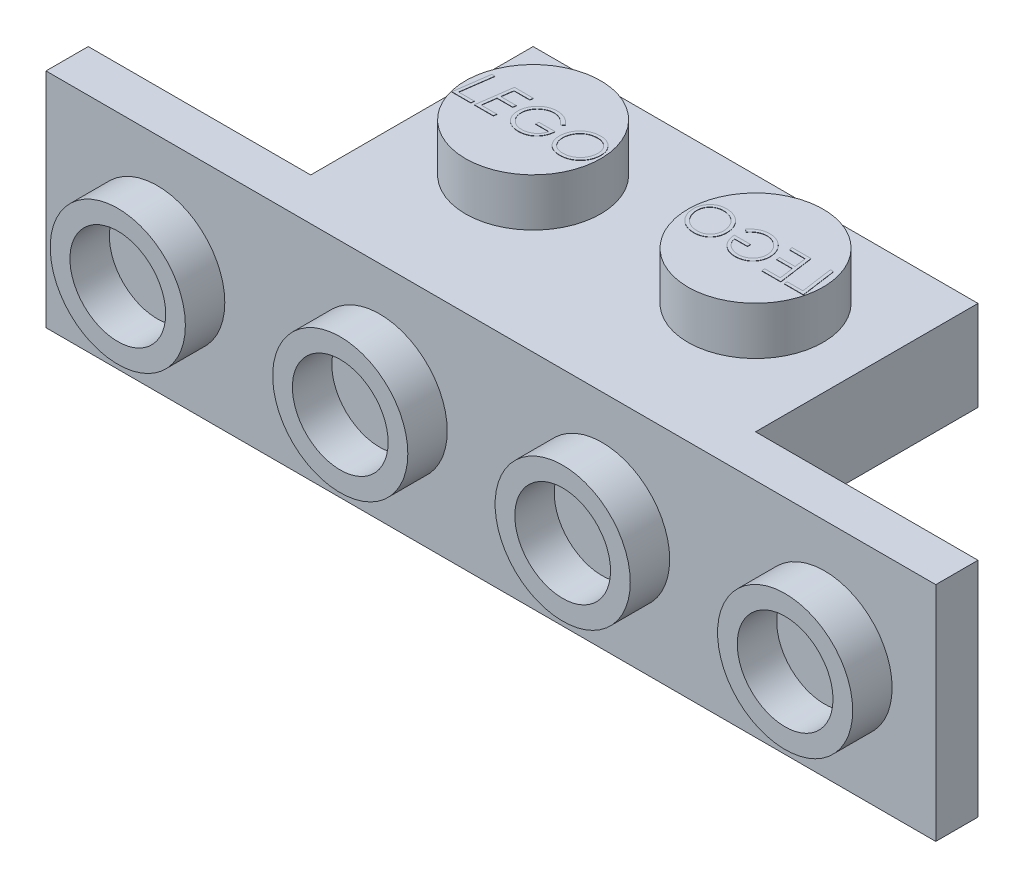
from build123d import *

# Parameters (mm, degrees)
SKETCH1_W           = 7.9
SKETCH1_H           = 7.9
BOSS_EXTRUDE1_DEPTH = 3.2
SKETCH2_R           = 2.4
BOSS_EXTRUDE2_DEPTH = 1.7
BOSS_EXTRUDE4_DEPTH = 0.01
SKETCH4_W           = 6.679581062
SKETCH4_H           = 6.679581062
CUT_EXTRUDE1_DEPTH  = 2.01
BOSS_EXTRUDE5_START = -2.01
BOSS_EXTRUDE5_DEPTH = 2.01
SKETCH6_W           = 7.9
SKETCH6_H           = 3.2
BOSS_EXTRUDE6_DEPTH = 1.5
SKETCH7_R           = 2.4
SKETCH7_R_2         = 1.7
BOSS_EXTRUDE7_DEPTH = 1.4


with BuildPart() as part:
    # Sketch1 → Boss-Extrude1 (new body)
    with BuildSketch(Plane(origin=(0, 0, 0), x_dir=(1, 0, 0), z_dir=(0, 1, 0))):
        with Locations((3.95, 3.95)):
            Rectangle(SKETCH1_W, SKETCH1_H)
    extrude(amount=BOSS_EXTRUDE1_DEPTH)

    # Sketch2 → Boss-Extrude2 (add)
    with BuildSketch(Plane(origin=(0, 3.2, 0), x_dir=(1, 0, 0), z_dir=(0, 1, 0))):
        with Locations(Location((3.95, 3.95, 0), (0, 0, 270))):
            Circle(SKETCH2_R)
    extrude(amount=BOSS_EXTRUDE2_DEPTH)

    # Sketch3 → Boss-Extrude4 (add)
    # profile 1 of 4: a face of its own
    with BuildSketch(Plane(origin=(0, 4.9, 0), x_dir=(1, 0, 0), z_dir=(0, 1, 0))):
        Polygon((1.832282536, 4.604898123), (1.945463626, 4.604898123), (1.785708017, 3.46707761), (2.346104652, 3.46707761), (2.331831815, 3.354898123), (1.657002088, 3.354898123), align=None)
    # profile 2 of 4: a face of its own
    with BuildSketch(Plane(origin=(0, 4.9, 0), x_dir=(1, 0, 0), z_dir=(0, 1, 0))):
        Polygon((3.307643113, 4.604898123), (3.289864668, 4.492718636), (2.730720036, 4.492718636), (2.672376687, 4.076051969), (3.227514908, 4.076051969), (3.211489267, 3.963872482), (2.656351046, 3.963872482), (2.586990069, 3.46707761), (3.147386703, 3.46707761), (3.132863466, 3.354898123), (2.458284139, 3.354898123), (2.633564588, 4.604898123), align=None)
    # profile 3 of 4: a face of its own
    with BuildSketch(Plane(origin=(0, 4.9, 0), x_dir=(1, 0, 0), z_dir=(0, 1, 0))):
        with BuildLine():
            Line((4.701873883, 4.341727049), (4.602214428, 4.268359661))
            add(Edge.make_bspline(
                [(4.602214428, 4.268359661), (4.594223081, 4.278463296), (4.578382454, 4.298490949), (4.552974208, 4.326751799), (4.526781942, 4.353389692), (4.49925824, 4.377917229), (4.471083571, 4.40112998), (4.441525281, 4.42204341), (4.410978563, 4.441207159), (4.379659496, 4.458649755), (4.347610579, 4.474125482), (4.315396207, 4.487732834), (4.282869127, 4.498922357), (4.250283005, 4.50864136), (4.217299487, 4.51587276), (4.18414763, 4.520710487), (4.150903008, 4.524293062), (4.128633082, 4.524610402), (4.117438786, 4.524769918)],
                knots=[0, 0, 0, 0, 1.088205139, 2.157064813, 3.209299296, 4.24303109, 5.270682624, 6.292193363, 7.299904734, 8.316436989, 9.319473328, 10.305733085, 11.269264382, 12.22444877, 13.177574148, 14.119122834, 15.054550362, 16, 16, 16, 16], degree=3))
            add(Edge.make_bspline(
                [(4.117438786, 4.524769918), (4.104994375, 4.524521107), (4.080132736, 4.524024028), (4.043033101, 4.520256885), (4.006376299, 4.51354748), (3.969908323, 4.504926578), (3.933893833, 4.493301772), (3.898252767, 4.479273564), (3.86309309, 4.462612711), (3.828430169, 4.443710217), (3.794953431, 4.422557236), (3.762954424, 4.399818018), (3.733183783, 4.375017311), (3.704650221, 4.34913067), (3.678490591, 4.320990985), (3.654040353, 4.291325456), (3.631570613, 4.259970376), (3.610753816, 4.22729124), (3.592321888, 4.193377608), (3.576332398, 4.158696131), (3.562301633, 4.123622124), (3.551463822, 4.087613068), (3.542488613, 4.051135011), (3.536702509, 4.013925289), (3.532682003, 3.976230124), (3.532229884, 3.950862463), (3.532002088, 3.938081216)],
                knots=[0, 0, 0, 0, 0.97704485, 1.95195533, 2.923843304, 3.901415526, 4.89212417, 5.89249681, 6.906854198, 7.94508701, 8.99059592, 10.014519948, 11.024825533, 12.031297736, 13.037428488, 14.038509295, 15.047964276, 16.064309815, 17.079005887, 18.075937854, 19.061713623, 20.042247028, 21.026191147, 22.008802999, 22.996754876, 24, 24, 24, 24], degree=3))
            add(Edge.make_bspline(
                [(3.532002088, 3.938081216), (3.532369323, 3.920940483), (3.533092921, 3.887166428), (3.54080397, 3.83756171), (3.552297071, 3.789703796), (3.569345009, 3.743984102), (3.590663785, 3.700113704), (3.616898701, 3.658340736), (3.647995923, 3.618632516), (3.683169388, 3.581124089), (3.721975609, 3.547190184), (3.762989457, 3.517071082), (3.806208637, 3.491553815), (3.851780792, 3.471217023), (3.899058754, 3.454481236), (3.948703848, 3.443615036), (4.000192874, 3.436168993), (4.035279814, 3.435410998), (4.053085822, 3.435026328)],
                knots=[0, 0, 0, 0, 1.019699772, 2.00921373, 2.981850619, 3.945611549, 4.907936516, 5.881372837, 6.876399243, 7.906447893, 8.938173367, 9.941073143, 10.932270214, 11.919723139, 12.908225854, 13.912405215, 14.940582182, 16, 16, 16, 16], degree=3))
            add(Edge.make_bspline(
                [(4.053085822, 3.435026328), (4.074581254, 3.435599426), (4.11748625, 3.436743331), (4.180872469, 3.447608002), (4.243162184, 3.464003995), (4.303115661, 3.48756372), (4.359892332, 3.516274774), (4.411741714, 3.54979345), (4.457784869, 3.587961635), (4.498384943, 3.630580026), (4.53303885, 3.678554542), (4.563120551, 3.731230233), (4.587740602, 3.789373269), (4.599634966, 3.830601123), (4.605720036, 3.851692995)],
                knots=[0, 0, 0, 0, 1.033792167, 2.063454529, 3.086685911, 4.12966393, 5.157365104, 6.144632769, 7.094686579, 8.02963692, 8.969786061, 9.935985671, 10.944065236, 12, 12, 12, 12], degree=3))
            Line((4.605720036, 3.851692995), (4.140976447, 3.851692995))
            Line((4.140976447, 3.851692995), (4.140976447, 3.963872482))
            Line((4.140976447, 3.963872482), (4.717899524, 3.963872482))
            add(Edge.make_bspline(
                [(4.717899524, 3.963872482), (4.715864452, 3.940537279), (4.711874195, 3.894782885), (4.69942647, 3.828086612), (4.68199329, 3.764774229), (4.659173945, 3.704861641), (4.630919519, 3.648505742), (4.59774963, 3.595348644), (4.559285746, 3.545571633), (4.515814341, 3.499721655), (4.46844757, 3.458302738), (4.417878433, 3.421925394), (4.364351012, 3.391393009), (4.308182236, 3.366007973), (4.248908241, 3.346854494), (4.187007442, 3.33278705), (4.12217798, 3.324364805), (4.078067373, 3.323359246), (4.055589828, 3.322846841)],
                knots=[0, 0, 0, 0, 1.098006248, 2.152910829, 3.176693714, 4.174102283, 5.154427425, 6.128677043, 7.108165613, 8.099464247, 9.087077226, 10.054952015, 11.015803916, 11.972468591, 12.940477937, 13.931877037, 14.946141749, 16, 16, 16, 16], degree=3))
            add(Edge.make_bspline(
                [(4.055589828, 3.322846841), (4.032525547, 3.323342362), (3.987411429, 3.324311611), (3.9214857, 3.332876212), (3.858807865, 3.34620412), (3.799404334, 3.365318809), (3.743277296, 3.389857102), (3.690679177, 3.420179827), (3.641268759, 3.455657405), (3.595689928, 3.496348401), (3.554559756, 3.541197331), (3.518567584, 3.589307242), (3.487743642, 3.639999747), (3.462901044, 3.693721351), (3.443468533, 3.750181555), (3.429856098, 3.809437188), (3.421311108, 3.871476007), (3.420325278, 3.913764014), (3.419822601, 3.935326809)],
                knots=[0, 0, 0, 0, 1.117903688, 2.186638197, 3.21780727, 4.221242465, 5.20706516, 6.182431358, 7.159609539, 8.151436913, 9.139682433, 10.10533578, 11.060397566, 12.011007066, 12.969638005, 13.950363306, 14.954883424, 16, 16, 16, 16], degree=3))
            add(Edge.make_bspline(
                [(3.419822601, 3.935326809), (3.420138952, 3.950859376), (3.420767729, 3.981731803), (3.424963713, 4.027616327), (3.432679126, 4.072646659), (3.442852825, 4.116910735), (3.455965552, 4.160496846), (3.471933961, 4.20328178), (3.491087489, 4.245242481), (3.513047729, 4.286115161), (3.537530339, 4.325600602), (3.564271155, 4.363247138), (3.593498243, 4.398542313), (3.624507556, 4.432098501), (3.658146201, 4.463054417), (3.693847346, 4.491888255), (3.731480716, 4.518905381), (3.77142415, 4.543221398), (3.812846375, 4.565137356), (3.855118915, 4.584605211), (3.898469674, 4.600573637), (3.942428974, 4.613905323), (3.987291028, 4.624144078), (4.032916476, 4.631801844), (4.079465257, 4.63599767), (4.110753822, 4.636631416), (4.12645321, 4.636949405)],
                knots=[0, 0, 0, 0, 1.01034602, 2.008157081, 2.993527994, 3.979930372, 4.960683832, 5.951959865, 6.948100503, 7.958563211, 8.967975239, 9.968308804, 10.959584837, 11.946808627, 12.938010319, 13.930059161, 14.930392727, 15.949048275, 16.969091794, 17.977364349, 18.973726886, 19.971641333, 20.963333569, 21.964771492, 22.978801278, 24, 24, 24, 24], degree=3))
            add(Edge.make_bspline(
                [(4.12645321, 4.636949405), (4.140647989, 4.63666956), (4.168739982, 4.636115737), (4.210476499, 4.63288549), (4.251380819, 4.627152534), (4.29129634, 4.618801418), (4.330484053, 4.608567941), (4.368675988, 4.59577053), (4.406070924, 4.580754735), (4.442474857, 4.563343269), (4.478143584, 4.543914061), (4.512619765, 4.521658579), (4.546625807, 4.497640881), (4.579591338, 4.471153536), (4.611552577, 4.442077414), (4.642675265, 4.410871755), (4.673242279, 4.377555225), (4.692243855, 4.353777591), (4.701873883, 4.341727049)],
                knots=[0, 0, 0, 0, 1.015105213, 2.008930748, 2.991454354, 3.966534974, 4.923490216, 5.886087319, 6.844809209, 7.803252371, 8.770243484, 9.747130909, 10.735853235, 11.746297741, 12.768902994, 13.824016992, 14.897208497, 16, 16, 16, 16], degree=3))
        make_face()
    # profile 4 of 4: a face of its own
    with BuildSketch(Plane(origin=(0, 4.9, 0), x_dir=(1, 0, 0), z_dir=(0, 1, 0))):
        with BuildLine():
            add(Edge.make_bspline(
                [(5.671925966, 4.636949405), (5.692400623, 4.63650345), (5.732667893, 4.635626396), (5.791703582, 4.627669814), (5.84816478, 4.614697282), (5.901922783, 4.596339067), (5.953136821, 4.572927607), (6.001690741, 4.544284414), (6.047399306, 4.510158163), (6.09025375, 4.471611385), (6.129154607, 4.429051867), (6.163160058, 4.383201547), (6.192058383, 4.334734533), (6.215910086, 4.283554512), (6.233823478, 4.229366588), (6.246743033, 4.172603876), (6.255145963, 4.113110877), (6.255950492, 4.072491917), (6.256361062, 4.051763107)],
                knots=[0, 0, 0, 0, 1.061681398, 2.087996504, 3.083659545, 4.062660971, 5.02945529, 5.999994507, 6.981138296, 7.983640916, 8.985844288, 9.966988076, 10.939736476, 11.908342154, 12.890058995, 13.894159216, 14.925339913, 16, 16, 16, 16], degree=3))
            add(Edge.make_bspline(
                [(6.256361062, 4.051763107), (6.25623821, 4.038988627), (6.255995471, 4.01374805), (6.253408976, 3.976225127), (6.249128591, 3.939561124), (6.243455349, 3.903597875), (6.235835613, 3.868539787), (6.226924527, 3.834140064), (6.216051359, 3.800598383), (6.20384118, 3.767696929), (6.189792262, 3.735595516), (6.173946521, 3.704324105), (6.15669213, 3.673663515), (6.137607818, 3.643838863), (6.11686312, 3.614849105), (6.094393683, 3.586665409), (6.070489857, 3.559187301), (6.044887258, 3.532733386), (6.018336956, 3.507212599), (5.990529993, 3.48355884), (5.962091012, 3.461350566), (5.932834084, 3.440746086), (5.90250067, 3.422121085), (5.871581935, 3.404690573), (5.839905885, 3.388861691), (5.807185809, 3.375183309), (5.773789823, 3.362832151), (5.739620564, 3.352089492), (5.704582969, 3.343076229), (5.668762424, 3.335500733), (5.632062087, 3.329787275), (5.594535036, 3.325855801), (5.556279304, 3.323200874), (5.530454147, 3.322965537), (5.51742877, 3.322846841)],
                knots=[0, 0, 0, 0, 1.057694632, 2.089855924, 3.112648636, 4.113725536, 5.103331559, 6.082381806, 7.055068159, 8.021768845, 8.98743121, 9.954922249, 10.923671581, 11.89959402, 12.885451751, 13.874212627, 14.883322035, 15.900071676, 16.921812937, 17.931632203, 18.921551953, 19.909055848, 20.892997665, 21.867769094, 22.84762411, 23.823252803, 24.802912784, 25.795362855, 26.787788858, 27.797679081, 28.826061376, 29.861826465, 30.921574152, 32, 32, 32, 32], degree=3))
            add(Edge.make_bspline(
                [(5.51742877, 3.322846841), (5.495540081, 3.323312388), (5.45279647, 3.324221496), (5.390401025, 3.331753811), (5.331466149, 3.34468508), (5.275615882, 3.361975519), (5.223270197, 3.38492417), (5.174339628, 3.412892082), (5.128783581, 3.445910526), (5.086763869, 3.483632016), (5.049135515, 3.525626819), (5.016044394, 3.570822838), (4.988418107, 3.619388761), (4.96538613, 3.670881503), (4.948106883, 3.725740589), (4.935156589, 3.783416472), (4.927613141, 3.844314319), (4.926699871, 3.88597706), (4.926232857, 3.907281937)],
                knots=[0, 0, 0, 0, 1.121422378, 2.189881799, 3.214223923, 4.209829567, 5.180887389, 6.136870002, 7.092517675, 8.058664933, 9.02481219, 9.976998316, 10.923432162, 11.882748215, 12.86205079, 13.865508147, 14.908495107, 16, 16, 16, 16], degree=3))
            add(Edge.make_bspline(
                [(4.926232857, 3.907281937), (4.92651465, 3.92390256), (4.927073619, 3.956871533), (4.931757127, 4.005792823), (4.939128338, 4.053761359), (4.950024433, 4.100549976), (4.963594459, 4.14639076), (4.979990494, 4.191253803), (5.000003008, 4.234848241), (5.022452359, 4.277389438), (5.047513645, 4.318359564), (5.07559856, 4.356880644), (5.105216605, 4.393691441), (5.137816677, 4.42780852), (5.172496353, 4.459796588), (5.209524734, 4.489546335), (5.248906172, 4.516814917), (5.290422211, 4.541753927), (5.333531205, 4.564369022), (5.378335052, 4.583562961), (5.424193072, 4.600182058), (5.471345954, 4.613795807), (5.519847317, 4.623918047), (5.569406413, 4.631466127), (5.620254649, 4.636113027), (5.6545551, 4.636668231), (5.671925966, 4.636949405)],
                knots=[0, 0, 0, 0, 1.027038055, 2.037251559, 3.03463374, 4.024476576, 5.003805404, 5.987972729, 6.973761106, 7.966047439, 8.95963362, 9.938921687, 10.910571097, 11.877553313, 12.852319973, 13.824735949, 14.81069978, 15.81041387, 16.816403723, 17.816876174, 18.82042938, 19.829469955, 20.847307225, 21.880377804, 22.926554263, 24, 24, 24, 24], degree=3))
        make_face()
        with BuildLine():
            add(Edge.make_bspline(
                [(5.671925966, 4.524769918), (5.65697579, 4.524545747), (5.627444828, 4.524102944), (5.583747158, 4.520086709), (5.541191397, 4.514393729), (5.499970629, 4.505322476), (5.459846772, 4.494612055), (5.421182876, 4.480527241), (5.383524652, 4.464643931), (5.34726264, 4.446055377), (5.312516644, 4.425361321), (5.279529586, 4.402463835), (5.248469657, 4.377453479), (5.219370347, 4.350164922), (5.191739723, 4.321307483), (5.166361885, 4.289965789), (5.142845474, 4.256628787), (5.121196386, 4.221501346), (5.10164712, 4.185107003), (5.08492909, 4.147719282), (5.070612165, 4.109847114), (5.058744989, 4.071497155), (5.049737471, 4.032481304), (5.043287884, 3.99291855), (5.039049877, 3.95269661), (5.03862585, 3.92565532), (5.038412344, 3.912039549)],
                knots=[0, 0, 0, 0, 1.093710758, 2.16039807, 3.20900896, 4.233234191, 5.246749975, 6.245527847, 7.241594159, 8.235879922, 9.224691631, 10.198908654, 11.171861231, 12.139893662, 13.116290872, 14.093089164, 15.087825051, 16.099756899, 17.110766713, 18.108591704, 19.094380672, 20.071961556, 21.043859171, 22.021859724, 23.00397114, 24, 24, 24, 24], degree=3))
            add(Edge.make_bspline(
                [(5.038412344, 3.912039549), (5.038625982, 3.900599914), (5.039049193, 3.877938292), (5.041777549, 3.844392517), (5.046595514, 3.811801965), (5.053065301, 3.780081073), (5.061542906, 3.749273697), (5.072183234, 3.719394567), (5.084405544, 3.690349568), (5.098393626, 3.662290632), (5.114175341, 3.635553687), (5.131389377, 3.61020951), (5.150226394, 3.586682218), (5.170360361, 3.564729612), (5.191972025, 3.544421151), (5.214980987, 3.52555365), (5.239648771, 3.508615875), (5.265465573, 3.492943288), (5.292687864, 3.479247808), (5.321165948, 3.467438697), (5.350786278, 3.457432665), (5.381544214, 3.449135171), (5.413524888, 3.442928532), (5.44663118, 3.438448028), (5.480905707, 3.435639812), (5.504152208, 3.435232585), (5.515926367, 3.435026328)],
                knots=[0, 0, 0, 0, 1.083699529, 2.146780792, 3.185591126, 4.202843058, 5.211856999, 6.209655863, 7.20532214, 8.195415879, 9.177202942, 10.14436246, 11.095191523, 12.029705806, 12.963818608, 13.902338257, 14.845476191, 15.796042213, 16.761390084, 17.729066592, 18.714222808, 19.721158958, 20.74459932, 21.797962164, 22.884686177, 24, 24, 24, 24], degree=3))
            add(Edge.make_bspline(
                [(5.515926367, 3.435026328), (5.530044188, 3.435228857), (5.558004277, 3.435629962), (5.599524853, 3.440000997), (5.64032433, 3.445959686), (5.680325762, 3.455225454), (5.71965402, 3.466535035), (5.757982705, 3.481070895), (5.795756024, 3.497476377), (5.83237428, 3.51683082), (5.867802238, 3.538111172), (5.901266528, 3.561837848), (5.932774032, 3.587459191), (5.962816859, 3.614626895), (5.990234918, 3.644356353), (6.016009711, 3.675809964), (6.039684501, 3.709331455), (6.061465654, 3.744601276), (6.080935982, 3.781209824), (6.097718361, 3.818903041), (6.112024773, 3.857287248), (6.123844079, 3.896320217), (6.132886835, 3.936161865), (6.139301688, 3.976648339), (6.14355343, 4.017951988), (6.143970816, 4.04574289), (6.144181575, 4.059775927)],
                knots=[0, 0, 0, 0, 1.029812959, 2.039525905, 3.043952503, 4.036919093, 5.033391511, 6.027870106, 7.026035071, 8.036794627, 9.047957848, 10.039952554, 11.027355318, 12.010276797, 12.992858524, 13.975534638, 14.976019862, 15.985163142, 16.99876328, 17.999396818, 18.993875413, 19.986244033, 20.973271002, 21.972624612, 22.976275263, 24, 24, 24, 24], degree=3))
            add(Edge.make_bspline(
                [(6.144181575, 4.059775927), (6.143688983, 4.077993105), (6.142724583, 4.113658826), (6.13551886, 4.16576722), (6.122807184, 4.214771606), (6.105892747, 4.261149785), (6.083400704, 4.304354629), (6.056090597, 4.344736825), (6.024020374, 4.382453222), (5.999069145, 4.404451295), (5.986429171, 4.415595238)],
                knots=[0, 0, 0, 0, 1.085318323, 2.124844004, 3.126009127, 4.096923137, 5.060061729, 6.020100862, 6.997008382, 8, 8, 8, 8], degree=3))
            add(Edge.make_bspline(
                [(5.986429171, 4.415595238), (5.97539623, 4.42431843), (5.953439426, 4.44167857), (5.917982347, 4.463870828), (5.881057133, 4.482788681), (5.842389242, 4.498145486), (5.802091847, 4.510165945), (5.760106575, 4.518646998), (5.716539836, 4.523741692), (5.686963766, 4.524423338), (5.671925966, 4.524769918)],
                knots=[0, 0, 0, 0, 0.992364662, 1.974918139, 2.947382948, 3.917989177, 4.907989082, 5.912266894, 6.938502841, 8, 8, 8, 8], degree=3))
        make_face(mode=Mode.SUBTRACT)
    extrude(amount=BOSS_EXTRUDE4_DEPTH)

    # Sketch4 → Cut-Extrude1 (cut)
    with BuildSketch(Plane.XZ):
        with Locations((3.960209469, -3.960209469)):
            Rectangle(SKETCH4_W, SKETCH4_H)
    extrude(amount=-CUT_EXTRUDE1_DEPTH, mode=Mode.SUBTRACT)

    # Sketch5 → Boss-Extrude5 (add)
    with BuildSketch(Plane(origin=(0, 3.2, 0), x_dir=(1, 0, 0), z_dir=(0, 1, 0)).offset(BOSS_EXTRUDE5_START)):
        with BuildLine():
            Line((6.369527619, 1.557811677), (5.363437843, 1.557811677))
            ThreePointArc((5.363437843, 1.557811677), (6.369527619, 0.551721901), (7.375617394, 1.557811677))
            ThreePointArc((7.375617394, 1.557811677), (7.080940521, 2.269224579), (6.369527619, 2.563901452))
            Line((6.369527619, 2.563901452), (6.369527619, 1.557811677))
        make_face()
        with BuildLine():
            Line((1.458127833, 2.579758881), (1.458127833, 1.557811677))
            Line((1.458127833, 1.557811677), (2.480075037, 1.557811677))
            ThreePointArc((2.480075037, 1.557811677), (2.180753631, 2.280437475), (1.458127833, 2.579758881))
        make_face()
        with BuildLine():
            Line((2.480075037, 1.557811677), (1.458127833, 1.557811677))
            Line((1.458127833, 1.557811677), (1.458127833, 2.579758881))
            ThreePointArc((1.458127833, 2.579758881), (0.735502035, 0.835185879), (2.480075037, 1.557811677))
        make_face()
        with BuildLine():
            ThreePointArc((5.605437996, 2.21232194), (5.425875301, 1.906719887), (5.363437843, 1.557811677))
            Line((5.363437843, 1.557811677), (6.369527619, 1.557811677))
            Line((6.369527619, 1.557811677), (6.369527619, 2.563901452))
            ThreePointArc((6.369527619, 2.563901452), (6.015263465, 2.499466361), (5.706377057, 2.31441459))
            ThreePointArc((5.706377057, 2.31441459), (5.656671092, 2.262613327), (5.605437996, 2.21232194))
        make_face()
        with BuildLine():
            ThreePointArc((7.385597221, 6.365232327), (6.369527619, 7.381301929), (5.353458016, 6.365232327))
            Line((5.353458016, 6.365232327), (6.369527619, 6.365232327))
            Line((6.369527619, 6.365232327), (6.369527619, 5.349162725))
            ThreePointArc((6.369527619, 5.349162725), (7.087997324, 5.646762621), (7.385597221, 6.365232327))
        make_face()
        with BuildLine():
            Line((6.369527619, 6.365232327), (5.353458016, 6.365232327))
            ThreePointArc((5.353458016, 6.365232327), (5.651057913, 5.646762621), (6.369527619, 5.349162725))
            Line((6.369527619, 5.349162725), (6.369527619, 6.365232327))
        make_face()
        with BuildLine():
            ThreePointArc((2.499242709, 6.365232327), (0.721948444, 7.101411716), (1.458127833, 5.324117451))
            Line((1.458127833, 5.324117451), (1.458127833, 6.365232327))
            Line((1.458127833, 6.365232327), (2.499242709, 6.365232327))
        make_face()
        with BuildLine():
            Line((1.458127833, 6.365232327), (1.458127833, 5.324117451))
            ThreePointArc((1.458127833, 5.324117451), (2.194307222, 5.629052938), (2.499242709, 6.365232327))
            Line((2.499242709, 6.365232327), (1.458127833, 6.365232327))
        make_face()
    extrude(amount=BOSS_EXTRUDE5_DEPTH)

    # Mirror1: part across plane


with BuildPart() as part_1:
    add(part.part)
    add(part.part.mirror(Plane(origin=(7.9, 3.2, 0), x_dir=(0, 0, 1), z_dir=(-1, 0, 0))))

    # Sketch6 → Boss-Extrude6 (add)
    with BuildSketch(Plane.XY):
        Polygon((-7.9, -4.7), (7.9, -4.7), (7.9, 0), (0, 0), (0, 3.2), (-7.9, 3.2), align=None)
        with Locations((3.95, 1.6)):
            Rectangle(SKETCH6_W, SKETCH6_H)
        with Locations((11.85, 1.6)):
            Rectangle(SKETCH6_W, SKETCH6_H)
        Polygon((23.7, -4.7), (23.7, 3.2), (15.8, 3.2), (15.8, 0), (7.9, 0), (7.9, -4.7), align=None)
    extrude(amount=BOSS_EXTRUDE6_DEPTH)

    # Sketch7 → Boss-Extrude7 (add)
    # profile 1 of 4: a face of its own
    with BuildSketch(Plane.XY.offset(1.5)):
        with Locations((-3.95, -0.75)):
            Circle(SKETCH7_R)
        with Locations((-3.95, -0.75)):
            Circle(SKETCH7_R_2, mode=Mode.SUBTRACT)
    # profile 2 of 4: a face of its own
    with BuildSketch(Plane.XY.offset(1.5)):
        with Locations((3.95, -0.75)):
            Circle(SKETCH7_R)
        with Locations((3.95, -0.75)):
            Circle(SKETCH7_R_2, mode=Mode.SUBTRACT)
    # profile 3 of 4: a face of its own
    with BuildSketch(Plane.XY.offset(1.5)):
        with Locations((11.85, -0.75)):
            Circle(SKETCH7_R)
        with Locations((11.85, -0.75)):
            Circle(SKETCH7_R_2, mode=Mode.SUBTRACT)
    # profile 4 of 4: a face of its own
    with BuildSketch(Plane.XY.offset(1.5)):
        with Locations((19.75, -0.75)):
            Circle(SKETCH7_R)
        with Locations((19.75, -0.75)):
            Circle(SKETCH7_R_2, mode=Mode.SUBTRACT)
    extrude(amount=BOSS_EXTRUDE7_DEPTH)


solid = part_1.part
